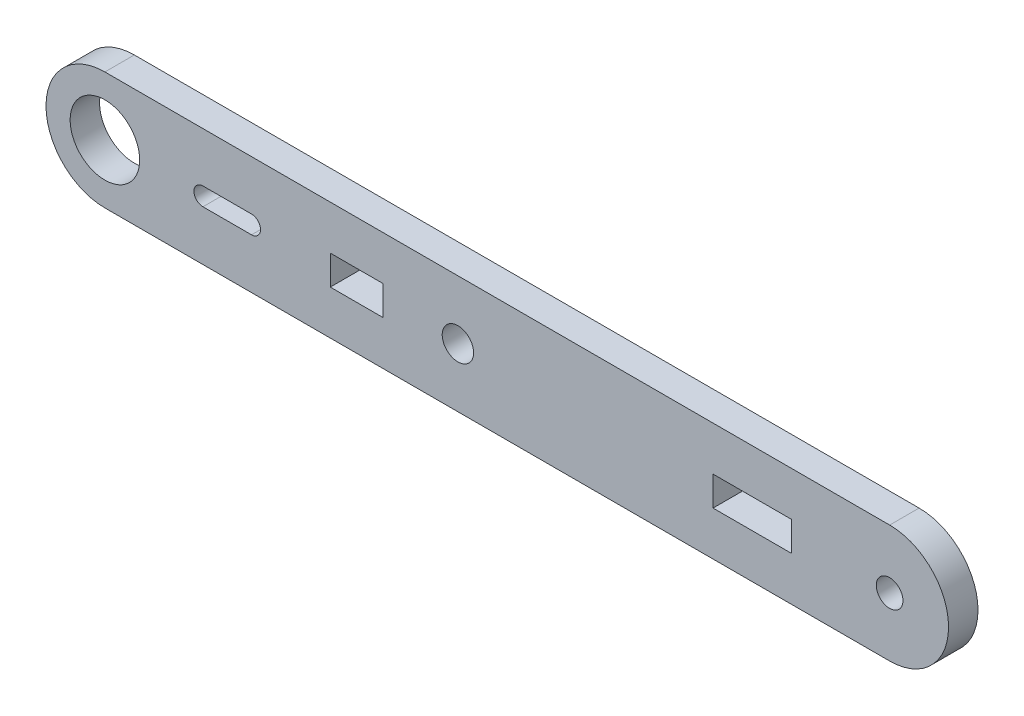
from build123d import *

# Parameters (mm, degrees)
SKETCH_1_R          = 1.357591064
SKETCH_1_R_2        = 3.543825796
SKETCH_1_W          = 5.3728
SKETCH_1_H          = 3.0001
SKETCH_1_W_2        = 7.9992
EXTRUDE_1_DEPTH     = 3
SKETCH_2_R          = 1.6
CUT_EXTRUDE_1_DEPTH = 57.708942736


with BuildPart() as part:
    # 草图1 → 凸台-拉伸1 (new body)
    with BuildSketch(Plane.XY.offset(3)):
        with BuildLine():
            Line((30.618171933, 12), (-49.343510787, 12))
            ThreePointArc((-49.343510787, 12), (-55.343510787, 6), (-49.343510787, 0))
            Line((-49.343510787, 0), (30.618171933, 0))
            ThreePointArc((30.618171933, 0), (36.618171933, 6), (30.618171933, 12))
        make_face()
        with Locations(Location((30.611606698, 6.0001, 0), (0, 0, 180))):
            Circle(SKETCH_1_R, mode=Mode.SUBTRACT)
        with Locations(Location((-13.375343302, 6.0002, 0), (0, 0, 180))):
            Circle(SKETCH_1_R, mode=Mode.SUBTRACT)
        with Locations(Location((-49.343510787, 6, 0), (0, 0, 180))):
            Circle(SKETCH_1_R_2, mode=Mode.SUBTRACT)
        with Locations((-23.691393302, 5.99945)):
            Rectangle(SKETCH_1_W, SKETCH_1_H, mode=Mode.SUBTRACT)
        with Locations((16.621706698, 5.99945)):
            Rectangle(SKETCH_1_W_2, SKETCH_1_H, mode=Mode.SUBTRACT)
        with BuildLine():
            Line((-34.404739086, 5.1001), (-39.352347519, 5.1001))
            ThreePointArc((-39.352347519, 5.1001), (-40.269423986, 6.017176468), (-39.352347519, 6.934252935))
            Line((-39.352347519, 6.934252935), (-34.404739086, 6.934252935))
            ThreePointArc((-34.404739086, 6.934252935), (-33.487662618, 6.017176468), (-34.404739086, 5.1001))
        make_face(mode=Mode.SUBTRACT)
    extrude(amount=-EXTRUDE_1_DEPTH)

    # 草图2 → 切除-拉伸1 (cut, through all)
    with BuildSketch(Plane.XY.offset(3)):
        with Locations((-13.375343302, 6.0002)):
            Circle(SKETCH_2_R)
    extrude(amount=-CUT_EXTRUDE_1_DEPTH, mode=Mode.SUBTRACT)


solid = part.part
